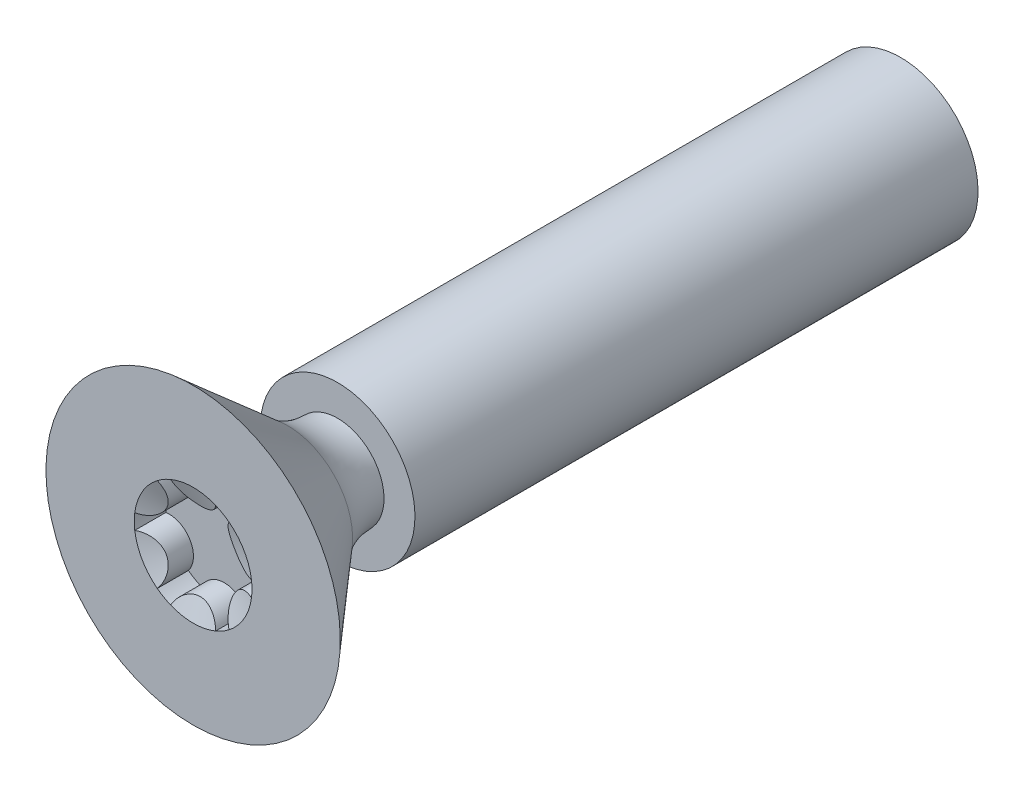
from build123d import *

# Parameters (mm, degrees)
CUT_EXTRUDE14_DEPTH = 0.8382
CIRPATTERN1_COUNT   = 6


with BuildPart() as part:
    # Sketch3 → Revolve1 (revolve)
    with BuildSketch(Plane(origin=(0, 0, 0), x_dir=(0, 0, -1), z_dir=(1, 0, 0)), mode=Mode.PRIVATE) as revolve1_sk:
        with BuildLine():
            Line((-5.635033784, 2.0828), (-5.635033784, 1.24968))
            ThreePointArc((-5.635033784, 1.24968), (-6.355652071, 1.379989014), (-6.985, 1.754411686))
            Line((-6.985, 1.754411686), (-9.525, 3.9624))
            Line((-9.525, 3.9624), (-9.525, 0))
            Line((-9.525, 0), (9.525, 0))
            Line((9.525, 0), (9.525, 2.0828))
            Line((9.525, 2.0828), (-5.635033784, 2.0828))
        make_face()
    revolve(revolve1_sk.sketch.rotate(Axis((0, 0, 9.525), (0, 0, -1)), 180), axis=Axis((0, 0, 9.525), (0, 0, -1)))

    # Sketch21 → Cut-Extrude14 (cut)
    with BuildSketch(Plane.XY.offset(9.525)):
        with BuildLine():
            Line((0, 0), (-0.79248, 1.372615624))
            ThreePointArc((-0.79248, 1.372615624), (-0.701009882, 1.42150742), (-0.606537933, 1.464312104))
            ThreePointArc((-0.606537933, 1.464312104), (0, 1.059036414), (0.606537933, 1.464312104))
            ThreePointArc((0.606537933, 1.464312104), (0.701009882, 1.42150742), (0.79248, 1.372615624))
            Line((0.79248, 1.372615624), (0, 0))
        make_face()
    cut_extrude14 = extrude(amount=-CUT_EXTRUDE14_DEPTH, mode=Mode.SUBTRACT)

    # CirPattern1: Cut-Extrude14 ×6 about axis
    cirpattern1_axis = Axis((0, 0, 0), (0, 0, 1))
    for i in range(1, CIRPATTERN1_COUNT):
        add(cut_extrude14.rotate(cirpattern1_axis, i * 360 / CIRPATTERN1_COUNT), mode=Mode.SUBTRACT)

    # Cut-Extrude15 cone 1 section (through the dimple's axis) → Cut-Extrude15 (revolve, cut)
    with BuildSketch(Plane(origin=(0, 0, 9.525), x_dir=(0, -1, 0), z_dir=(1, 0, 0))):
        Polygon((0, 0), (1.58496, 0), (0, 0.576878263), align=None)
    revolve(axis=Axis((0, 0, 9.525), (0, 0, -1)), mode=Mode.SUBTRACT)


solid = part.part
